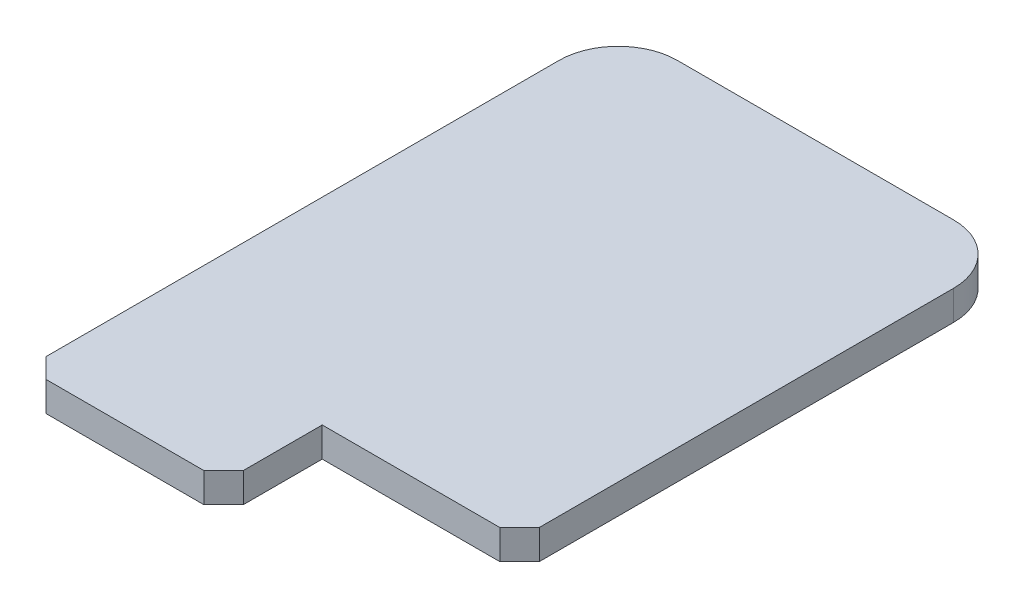
from build123d import *

# Parameters (mm, degrees)
BOSS_EXTRUDE1_DEPTH = 1.5
FILLET1_R           = 3
CHAMFER1_SIZE       = 1


with BuildPart() as part:
    # Sketch1 → Boss-Extrude1 (new body)
    with BuildSketch(Plane(origin=(0, 0, 0), x_dir=(1, 0, 0), z_dir=(0, 1, 0))):
        Polygon((0, 0), (0, 5), (10, 5), (10, 30), (-10, 30), (-10, 0), align=None)
    extrude(amount=BOSS_EXTRUDE1_DEPTH)

    # Fillet1
    fillet1_edges = [part.edges().sort_by_distance(p)[0] for p in [
        (-10, 0.75, -30),
        (10, 0.75, -30),
    ]]
    fillet(fillet1_edges, radius=FILLET1_R)

    # Chamfer1
    chamfer1_edges = [part.edges().sort_by_distance(p)[0] for p in [
        (-10, 0.75, 0),
        (10, 0.75, -5),
        (0, 0.75, 0),
    ]]
    chamfer(chamfer1_edges, length=CHAMFER1_SIZE)


solid = part.part
